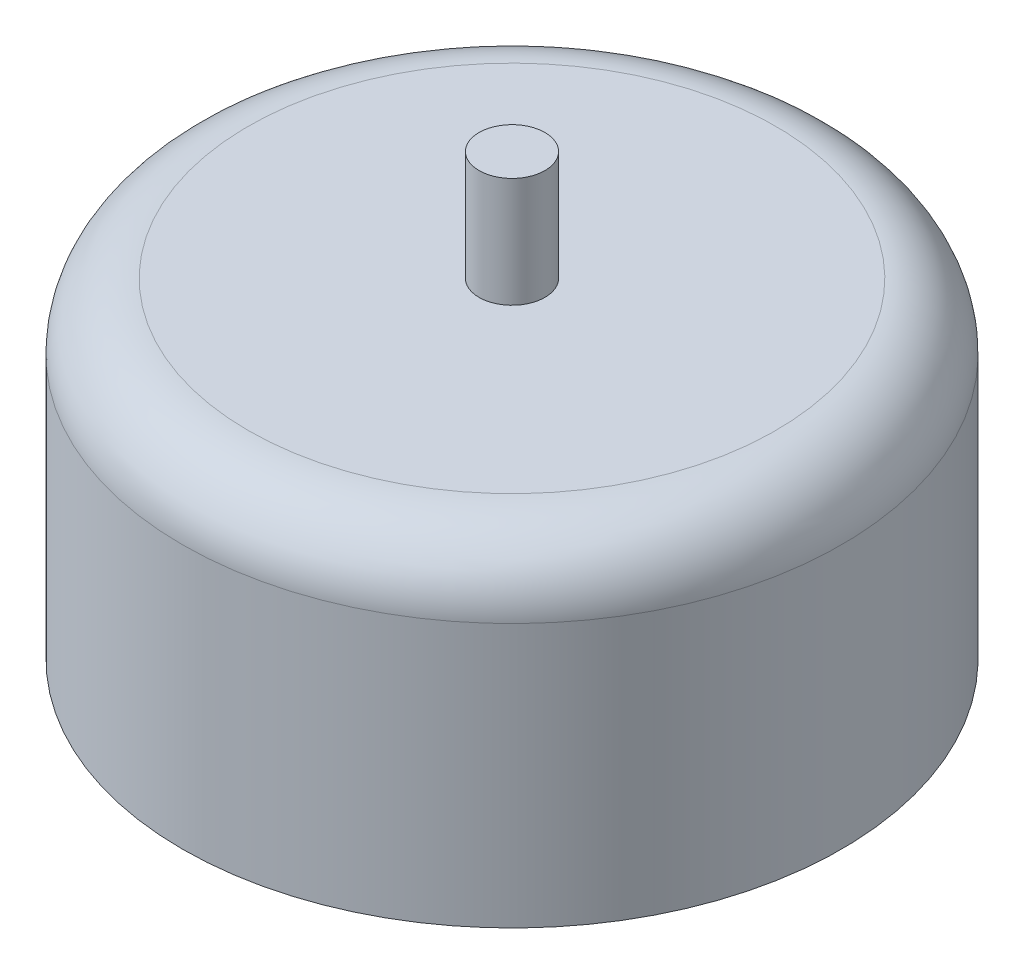
from build123d import *

# Parameters (mm, degrees)
SKETCH_2_R      = 15
EXTRUDE_1_DEPTH = 15
FILLET_1_R      = 3
SKETCH_3_R      = 1.5
EXTRUDE_2_DEPTH = 5
SKETCH_4_R      = 1.5
EXTRUDE_3_DEPTH = 2


with BuildPart() as part:
    # 草图2 → 凸台-拉伸1 (new body)
    with BuildSketch(Plane(origin=(0, 0, 0), x_dir=(1, 0, 0), z_dir=(0, 1, 0))):
        with Locations(Location((0, 0, 0), (0, 0, 270))):
            Circle(SKETCH_2_R)
    extrude(amount=EXTRUDE_1_DEPTH)

    # 圆角1
    fillet_1_edges = [part.edges().sort_by_distance(p)[0] for p in [
        (0, 15, -15),
    ]]
    fillet(fillet_1_edges, radius=FILLET_1_R)

    # 草图3 → 凸台-拉伸2 (add)
    with BuildSketch(Plane(origin=(0, 15, 0), x_dir=(1, 0, 0), z_dir=(0, 1, 0))):
        with Locations(Location((0, 0, 0), (0, 0, 270))):
            Circle(SKETCH_3_R)
    extrude(amount=EXTRUDE_2_DEPTH)

    # 草图4 → 凸台-拉伸3 (add)
    with BuildSketch(Plane.XZ):
        with Locations(Location((0, 5, 0), (0, 0, 90))):
            Circle(SKETCH_4_R)
        with Locations(Location((-5, 0, 0), (0, 0, 90))):
            Circle(SKETCH_4_R)
        with Locations(Location((5, 0, 0), (0, 0, 90))):
            Circle(SKETCH_4_R)
        with Locations(Location((0, -5, 0), (0, 0, 90))):
            Circle(SKETCH_4_R)
    extrude(amount=EXTRUDE_3_DEPTH)


solid = part.part
